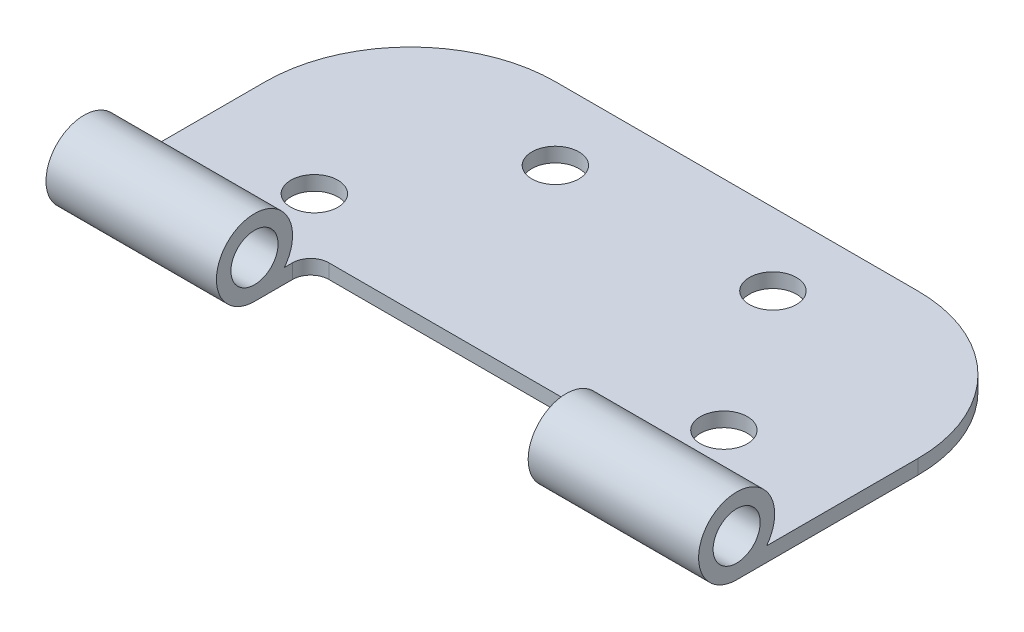
from build123d import *

# Parameters (mm, degrees)
SKETCH_1_R               = 3.24
EXTRUDE_1_DEPTH          = 2
SKETCH_2_R               = 5.25
SKETCH_2_R_2             = 3.25
EXTRUDE_2_DEPTH          = 90
CUT_EXTRUDE_1_DEPTH      = 54.547292182
CUT_EXTRUDE_1_DEPTH_BACK = 54.547292182


with BuildPart() as part:
    # Эскиз1 → Бобышка-Вытянуть1 (new body)
    with BuildSketch(Plane(origin=(0, 0, 0), x_dir=(1, 0, 0), z_dir=(0, 1, 0))):
        with BuildLine():
            Line((-25, 22.5), (25, 22.5))
            ThreePointArc((25, 22.5), (39.142135624, 16.642135624), (45, 2.5))
            Line((45, 2.5), (45, -22.5))
            Line((45, -22.5), (-45, -22.5))
            Line((-45, -22.5), (-45, 2.5))
            ThreePointArc((-45, 2.5), (-39.142135624, 16.642135624), (-25, 22.5))
        make_face()
        with Locations(Location((-28.24, -7.5, 0), (0, 0, 270))):
            Circle(SKETCH_1_R, mode=Mode.SUBTRACT)
        with Locations(Location((-15, 12.5, 0), (0, 0, 270))):
            Circle(SKETCH_1_R, mode=Mode.SUBTRACT)
        with Locations(Location((15, 12.5, 0), (0, 0, 90))):
            Circle(SKETCH_1_R, mode=Mode.SUBTRACT)
        with Locations(Location((28.24, -7.5, 0), (0, 0, 90))):
            Circle(SKETCH_1_R, mode=Mode.SUBTRACT)
    extrude(amount=EXTRUDE_1_DEPTH)

    # Эскиз2 → Бобышка-Вытянуть2 (add)
    with BuildSketch(Plane(origin=(45, 0, 0), x_dir=(0, 0, -1), z_dir=(1, 0, 0))):
        with Locations((-22.5, 5.25)):
            Circle(SKETCH_2_R)
        with Locations((-22.5, 5.25)):
            Circle(SKETCH_2_R_2, mode=Mode.SUBTRACT)
    extrude(amount=-EXTRUDE_2_DEPTH)

    # Эскиз3 → Вырез-Вытянуть1 (cut, two sides: drawn at the far end of the back side and taken through both)
    with BuildSketch(Plane(origin=(0, 2, 0), x_dir=(1, 0, 0), z_dir=(0, 1, 0)).offset(-CUT_EXTRUDE_1_DEPTH_BACK)):
        with BuildLine():
            Line((-21.495, -40.75), (21.495, -40.75))
            Line((21.495, -40.75), (21.495, -17.25))
            ThreePointArc((21.495, -17.25), (20.762766953, -15.482233047), (18.995, -14.75))
            Line((18.995, -14.75), (-18.995, -14.75))
            ThreePointArc((-18.995, -14.75), (-20.762766953, -15.482233047), (-21.495, -17.25))
            Line((-21.495, -17.25), (-21.495, -40.75))
        make_face()
    extrude(amount=CUT_EXTRUDE_1_DEPTH + CUT_EXTRUDE_1_DEPTH_BACK, mode=Mode.SUBTRACT)


solid = part.part
